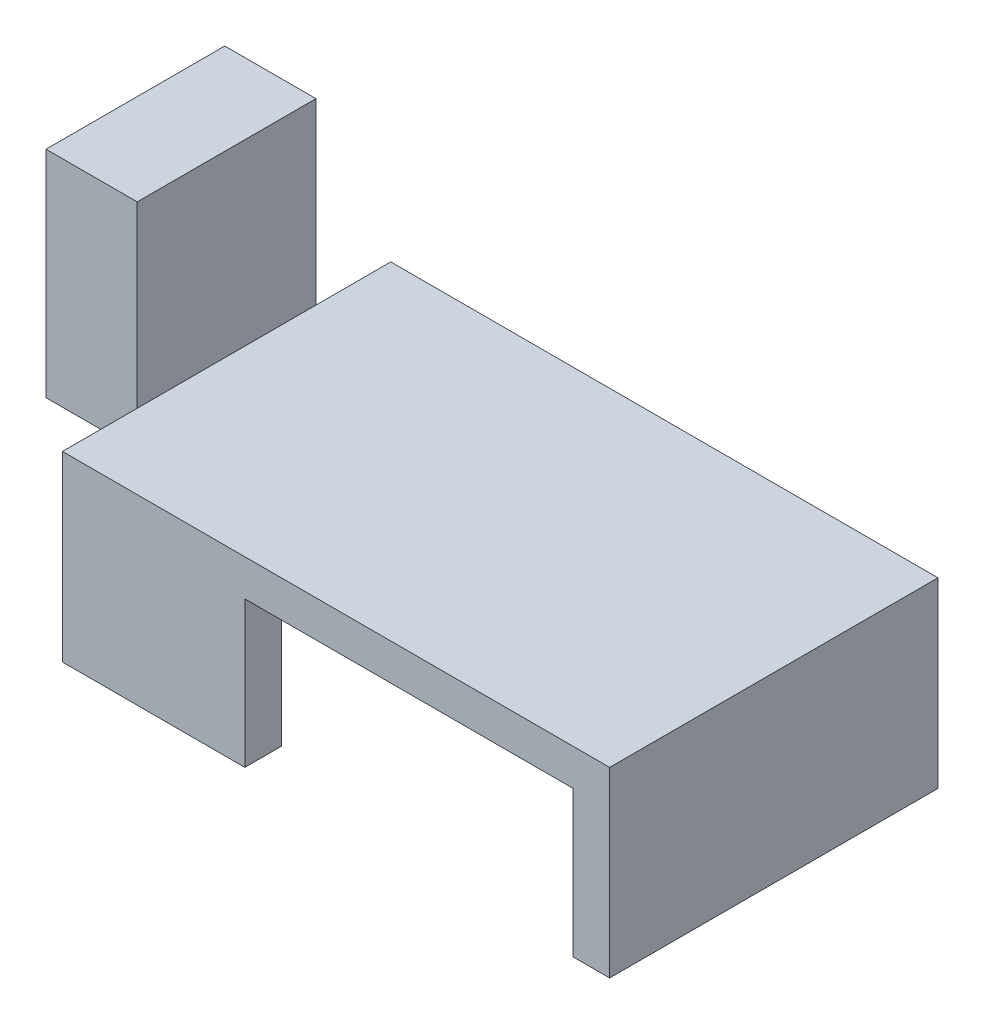
from build123d import *

# Parameters (mm, degrees)
SKETCH2_W            = 18
SKETCH2_H            = 18
BOSS_EXTRUDE1_DEPTH  = 2
SKETCH3_W            = 18
SKETCH3_H            = 2
BOSS_EXTRUDE2_DEPTH  = 8
SKETCH4_W            = 18
SKETCH4_H            = 2
BOSS_EXTRUDE3_DEPTH  = 12
BOSS_EXTRUDE4_DEPTH  = 8
SKETCH6_W            = 9.8
SKETCH6_H            = 2
BOSS_EXTRUDE5_DEPTH  = 5
SKETCH6_2_W          = 9.8
SKETCH6_2_H          = 2
BOSS_EXTRUDE7_DEPTH  = 5
SKETCH9_W            = 5
SKETCH9_H            = 9.8
BOSS_EXTRUDE8_DEPTH  = 9.8
SKETCH10_W           = 10
SKETCH10_H           = 8
CUT_EXTRUDE2_DEPTH   = 11.8
SKETCH11_W           = 2
SKETCH11_H           = 8
CUT_EXTRUDE4_DEPTH   = 8
SKETCH16_W           = 8
SKETCH16_H           = 8
CUT_EXTRUDE5_DEPTH   = 8
SKETCH17_W           = 2
SKETCH17_H           = 8
BOSS_EXTRUDE11_DEPTH = 8
SKETCH18_W           = 2
SKETCH18_H           = 8
CUT_EXTRUDE6_DEPTH   = 8


with BuildPart() as part:
    # Sketch2 → Boss-Extrude1 (new body)
    with BuildSketch(Plane(origin=(0, 0, 0), x_dir=(1, 0, 0), z_dir=(0, 1, 0))):
        Rectangle(SKETCH2_W, SKETCH2_H)
    extrude(amount=BOSS_EXTRUDE1_DEPTH)

    # Sketch3 → Boss-Extrude2 (add)
    with BuildSketch(Plane.XZ):
        with Locations((0, 8)):
            Rectangle(SKETCH3_W, SKETCH3_H)
        with Locations((0, -8)):
            Rectangle(SKETCH3_W, SKETCH3_H)
    extrude(amount=BOSS_EXTRUDE2_DEPTH)

    # Sketch4 → Boss-Extrude3 (add)
    with BuildSketch(Plane(origin=(9, 0, 0), x_dir=(0, 0, -1), z_dir=(1, 0, 0))):
        with Locations((0, 1)):
            Rectangle(SKETCH4_W, SKETCH4_H)
    extrude(amount=BOSS_EXTRUDE3_DEPTH)

    # Sketch5 → Boss-Extrude4 (add)
    with BuildSketch(Plane.XZ):
        Polygon((21, 9), (19, 9), (9, 9), (9, 7), (19, 7), (19, -9), (21, -9), align=None)
    extrude(amount=BOSS_EXTRUDE4_DEPTH)

    # Sketch6 → Boss-Extrude5 (add)
    with BuildSketch(Plane.ZY.offset(9)):
        with Locations((0, 1)):
            Rectangle(SKETCH6_W, SKETCH6_H)
    extrude(amount=BOSS_EXTRUDE5_DEPTH)

    # Sketch6<2> → Boss-Extrude7 (add)
    with BuildSketch(Plane.ZY.offset(9)):
        with Locations((0, 1)):
            Rectangle(SKETCH6_2_W, SKETCH6_2_H)
    extrude(amount=BOSS_EXTRUDE7_DEPTH)

    # Sketch9 → Boss-Extrude8 (add)
    with BuildSketch(Plane(origin=(0, 2, 0), x_dir=(1, 0, 0), z_dir=(0, 1, 0))):
        with Locations((-11.5, 0)):
            Rectangle(SKETCH9_W, SKETCH9_H)
    extrude(amount=BOSS_EXTRUDE8_DEPTH)

    # Sketch10 → Cut-Extrude2 (cut)
    with BuildSketch(Plane(origin=(0, 0, 7), x_dir=(-1, 0, 0), z_dir=(0, 0, -1))):
        with Locations((-14, -4)):
            Rectangle(SKETCH10_W, SKETCH10_H)
    extrude(amount=-CUT_EXTRUDE2_DEPTH, mode=Mode.SUBTRACT)

    # Sketch11 → Cut-Extrude4 (cut)
    with BuildSketch(Plane.ZY.offset(9)):
        with Locations((-8, -4)):
            Rectangle(SKETCH11_W, SKETCH11_H)
    extrude(amount=-CUT_EXTRUDE4_DEPTH, mode=Mode.SUBTRACT)

    # Sketch16 → Cut-Extrude5 (cut)
    with BuildSketch(Plane(origin=(0, 0, 7), x_dir=(-1, 0, 0), z_dir=(0, 0, -1))):
        with Locations((5, -4)):
            Rectangle(SKETCH16_W, SKETCH16_H)
    extrude(amount=-CUT_EXTRUDE5_DEPTH, mode=Mode.SUBTRACT)

    # Sketch17 → Boss-Extrude11 (add)
    with BuildSketch(Plane.ZY.offset(1)):
        with Locations((-8, -4)):
            Rectangle(SKETCH17_W, SKETCH17_H)
        with Locations((8, -4)):
            Rectangle(SKETCH17_W, SKETCH17_H)
    extrude(amount=BOSS_EXTRUDE11_DEPTH)

    # Sketch18 → Cut-Extrude6 (cut)
    with BuildSketch(Plane(origin=(9, 0, 0), x_dir=(0, 0, -1), z_dir=(1, 0, 0))):
        with Locations((8, -4)):
            Rectangle(SKETCH18_W, SKETCH18_H)
        with Locations((-8, -4)):
            Rectangle(SKETCH18_W, SKETCH18_H)
    extrude(amount=-CUT_EXTRUDE6_DEPTH, mode=Mode.SUBTRACT)


solid = part.part
